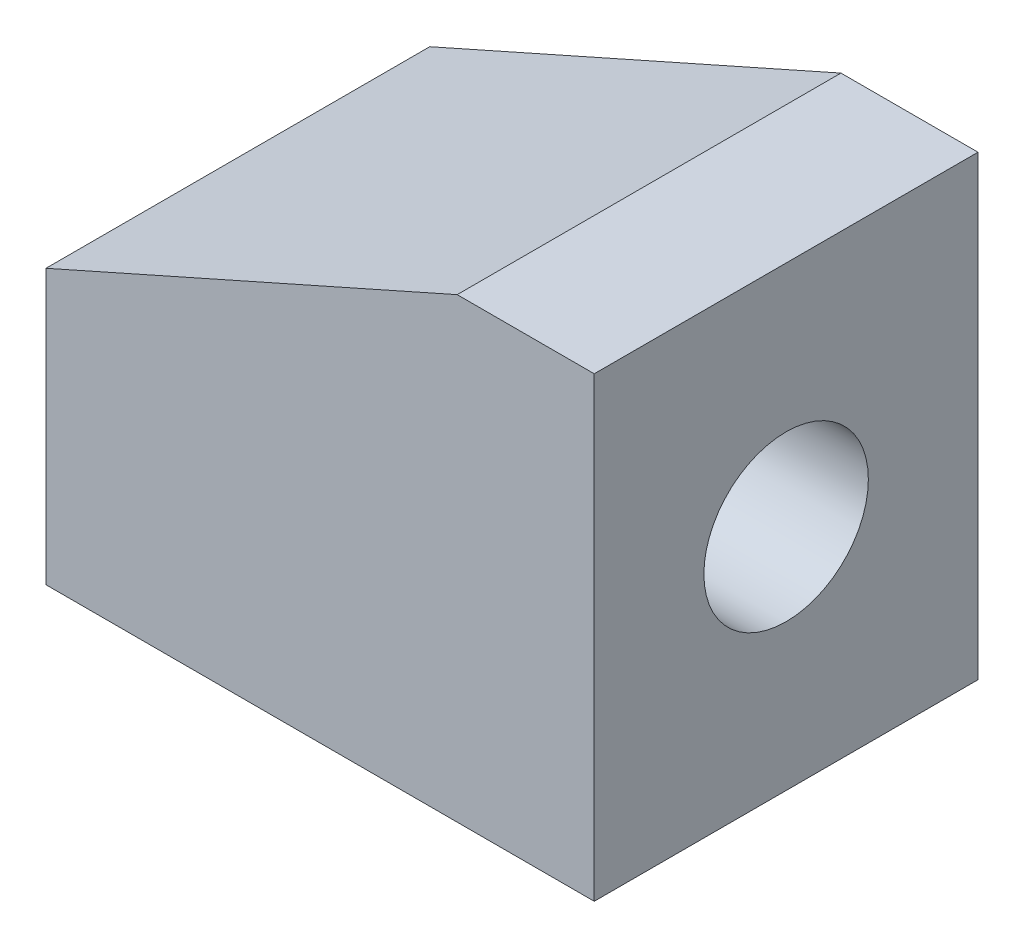
from build123d import *

# Parameters (mm, degrees)
BOSS_EXTRUDE1_DEPTH = 21
SKETCH2_R           = 9
CUT_EXTRUDE1_DEPTH  = 20


with BuildPart() as part:
    # Sketch1 → Boss-Extrude1 (new, symmetric)
    with BuildSketch(Plane.XY):
        Polygon((0, 0), (-60, 0), (-60, 30), (-15, 50), (0, 50), align=None)
    extrude(amount=BOSS_EXTRUDE1_DEPTH, both=True)

    # Sketch2 → Cut-Extrude1 (cut, symmetric)
    with BuildSketch(Plane(origin=(0, 0, 0), x_dir=(0, 0, -1), z_dir=(1, 0, 0))):
        with Locations(Location((0, 25, 0), (0, 0, 90))):
            Circle(SKETCH2_R)
    extrude(amount=CUT_EXTRUDE1_DEPTH, both=True, mode=Mode.SUBTRACT)


solid = part.part
